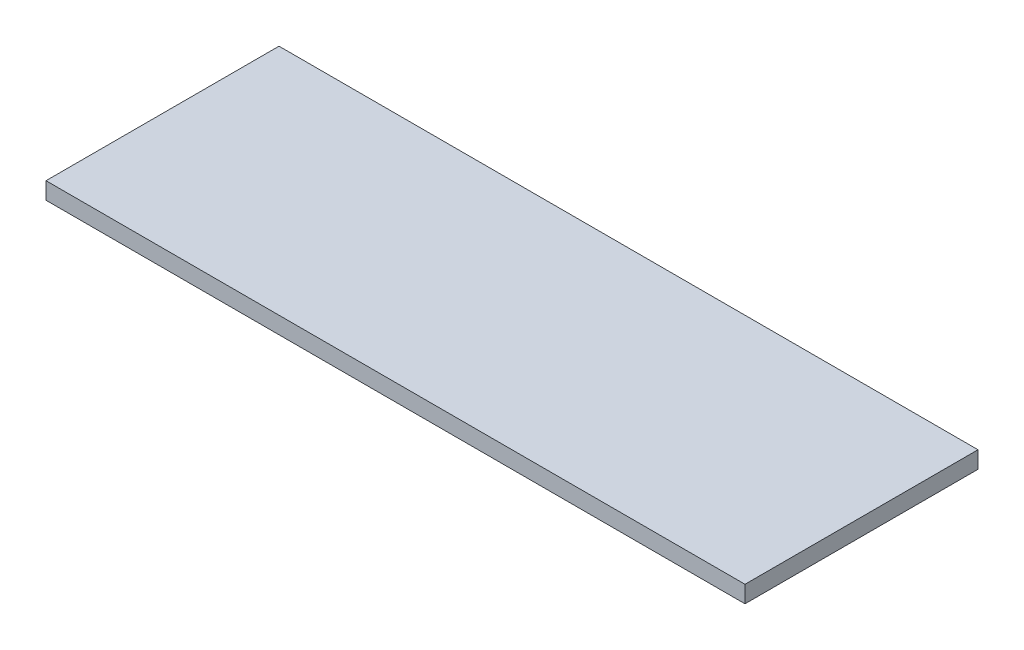
from build123d import *

# Parameters (mm, degrees)
CROQUIS1_W              = 66
CROQUIS1_H              = 22
SALIENTE_EXTRUIR1_DEPTH = 1.6


with BuildPart() as part:
    # Croquis1 → Saliente-Extruir1 (new body)
    with BuildSketch(Plane(origin=(0, 0, 0), x_dir=(1, 0, 0), z_dir=(0, 1, 0))):
        Rectangle(CROQUIS1_W, CROQUIS1_H)
    extrude(amount=SALIENTE_EXTRUIR1_DEPTH)


solid = part.part
